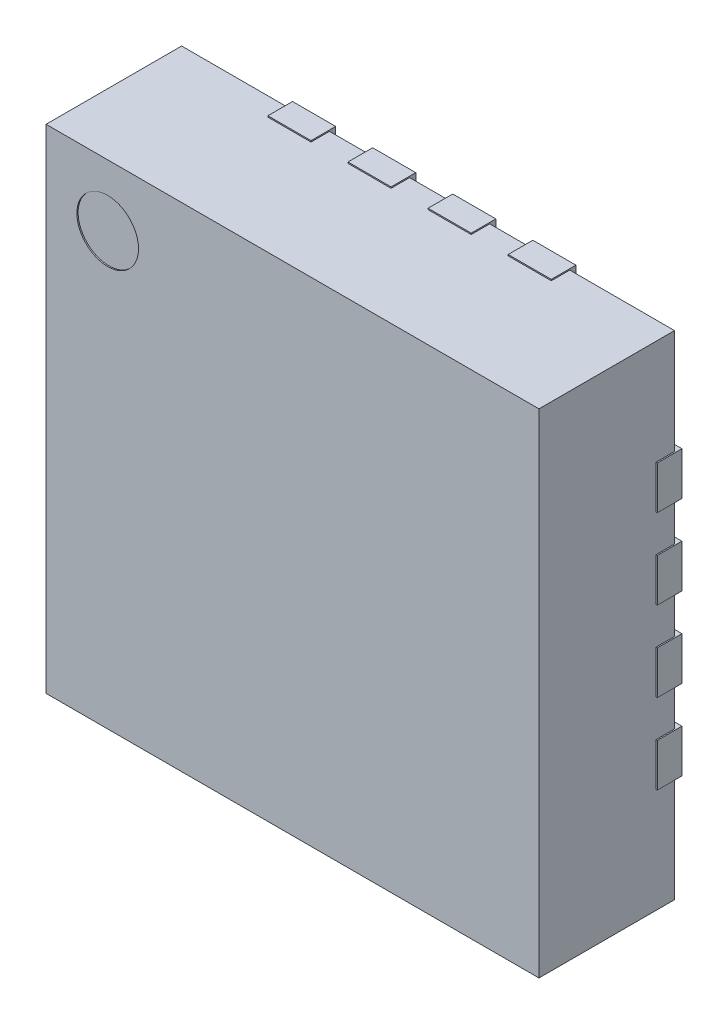
from build123d import *

# Parameters (mm, degrees)
ESBO_O1_W                = 4
ESBO_O1_H                = 4
RESSALTO_EXTRUS_O1_DEPTH = 1.1
RESSALTO_EXTRUS_O2_DEPTH = 0.2
ESBO_O3_R                = 0.25
CORTE_EXTRUS_O1_DEPTH    = 0.01


with BuildPart() as part:
    # Esboço1 → Ressalto-extrusão1 (new body)
    with BuildSketch(Plane.XY.offset(0.05)):
        Rectangle(ESBO_O1_W, ESBO_O1_H)
    extrude(amount=RESSALTO_EXTRUS_O1_DEPTH)

    # Esboço2 → Ressalto-extrusão2 (add)
    with BuildSketch(Plane.XY):
        Polygon((-1.05, -1.05), (1.05, -1.05), (1.05, 1.05), (-0.75, 1.05), (-1.05, 0.75), align=None)
        with BuildLine():
            Line((-0.8, -2.01), (-1.15, -2.01))
            Line((-1.15, -2.01), (-1.15, -1.635))
            ThreePointArc((-1.15, -1.635), (-0.975, -1.46), (-0.8, -1.635))
            Line((-0.8, -1.635), (-0.8, -2.01))
        make_face()
        with BuildLine():
            Line((-0.5, -2.01), (-0.5, -1.635))
            ThreePointArc((-0.5, -1.635), (-0.325, -1.46), (-0.15, -1.635))
            Line((-0.15, -1.635), (-0.15, -2.01))
            Line((-0.15, -2.01), (-0.5, -2.01))
        make_face()
        with BuildLine():
            Line((0.15, -2.01), (0.15, -1.635))
            ThreePointArc((0.15, -1.635), (0.325, -1.46), (0.5, -1.635))
            Line((0.5, -1.635), (0.5, -2.01))
            Line((0.5, -2.01), (0.15, -2.01))
        make_face()
        with BuildLine():
            Line((0.8, -2.01), (0.8, -1.635))
            ThreePointArc((0.8, -1.635), (0.975, -1.46), (1.15, -1.635))
            Line((1.15, -1.635), (1.15, -2.01))
            Line((1.15, -2.01), (0.8, -2.01))
        make_face()
        with BuildLine():
            Line((-2.01, 0.8), (-2.01, 1.15))
            Line((-2.01, 1.15), (-1.635, 1.15))
            ThreePointArc((-1.635, 1.15), (-1.46, 0.975), (-1.635, 0.8))
            Line((-1.635, 0.8), (-2.01, 0.8))
        make_face()
        with BuildLine():
            Line((-2.01, 0.5), (-1.635, 0.5))
            ThreePointArc((-1.635, 0.5), (-1.46, 0.325), (-1.635, 0.15))
            Line((-1.635, 0.15), (-2.01, 0.15))
            Line((-2.01, 0.15), (-2.01, 0.5))
        make_face()
        with BuildLine():
            Line((-2.01, -0.15), (-1.635, -0.15))
            ThreePointArc((-1.635, -0.15), (-1.46, -0.325), (-1.635, -0.5))
            Line((-1.635, -0.5), (-2.01, -0.5))
            Line((-2.01, -0.5), (-2.01, -0.15))
        make_face()
        with BuildLine():
            Line((-2.01, -0.8), (-1.635, -0.8))
            ThreePointArc((-1.635, -0.8), (-1.46, -0.975), (-1.635, -1.15))
            Line((-1.635, -1.15), (-2.01, -1.15))
            Line((-2.01, -1.15), (-2.01, -0.8))
        make_face()
        with BuildLine():
            Line((0.8, 2.01), (1.15, 2.01))
            Line((1.15, 2.01), (1.15, 1.635))
            ThreePointArc((1.15, 1.635), (0.975, 1.46), (0.8, 1.635))
            Line((0.8, 1.635), (0.8, 2.01))
        make_face()
        with BuildLine():
            Line((0.5, 2.01), (0.5, 1.635))
            ThreePointArc((0.5, 1.635), (0.325, 1.46), (0.15, 1.635))
            Line((0.15, 1.635), (0.15, 2.01))
            Line((0.15, 2.01), (0.5, 2.01))
        make_face()
        with BuildLine():
            Line((-0.15, 2.01), (-0.15, 1.635))
            ThreePointArc((-0.15, 1.635), (-0.325, 1.46), (-0.5, 1.635))
            Line((-0.5, 1.635), (-0.5, 2.01))
            Line((-0.5, 2.01), (-0.15, 2.01))
        make_face()
        with BuildLine():
            Line((-0.8, 2.01), (-0.8, 1.635))
            ThreePointArc((-0.8, 1.635), (-0.975, 1.46), (-1.15, 1.635))
            Line((-1.15, 1.635), (-1.15, 2.01))
            Line((-1.15, 2.01), (-0.8, 2.01))
        make_face()
        with BuildLine():
            Line((2.01, -0.8), (2.01, -1.15))
            Line((2.01, -1.15), (1.635, -1.15))
            ThreePointArc((1.635, -1.15), (1.46, -0.975), (1.635, -0.8))
            Line((1.635, -0.8), (2.01, -0.8))
        make_face()
        with BuildLine():
            Line((2.01, -0.5), (1.635, -0.5))
            ThreePointArc((1.635, -0.5), (1.46, -0.325), (1.635, -0.15))
            Line((1.635, -0.15), (2.01, -0.15))
            Line((2.01, -0.15), (2.01, -0.5))
        make_face()
        with BuildLine():
            Line((2.01, 0.15), (1.635, 0.15))
            ThreePointArc((1.635, 0.15), (1.46, 0.325), (1.635, 0.5))
            Line((1.635, 0.5), (2.01, 0.5))
            Line((2.01, 0.5), (2.01, 0.15))
        make_face()
        with BuildLine():
            Line((2.01, 0.8), (1.635, 0.8))
            ThreePointArc((1.635, 0.8), (1.46, 0.975), (1.635, 1.15))
            Line((1.635, 1.15), (2.01, 1.15))
            Line((2.01, 1.15), (2.01, 0.8))
        make_face()
    extrude(amount=RESSALTO_EXTRUS_O2_DEPTH)

    # Esboço3 → Corte-extrusão1 (cut)
    with BuildSketch(Plane.XY.offset(1.15)):
        with Locations((-1.5, 1.5)):
            Circle(ESBO_O3_R)
    extrude(amount=-CORTE_EXTRUS_O1_DEPTH, mode=Mode.SUBTRACT)


solid = part.part
